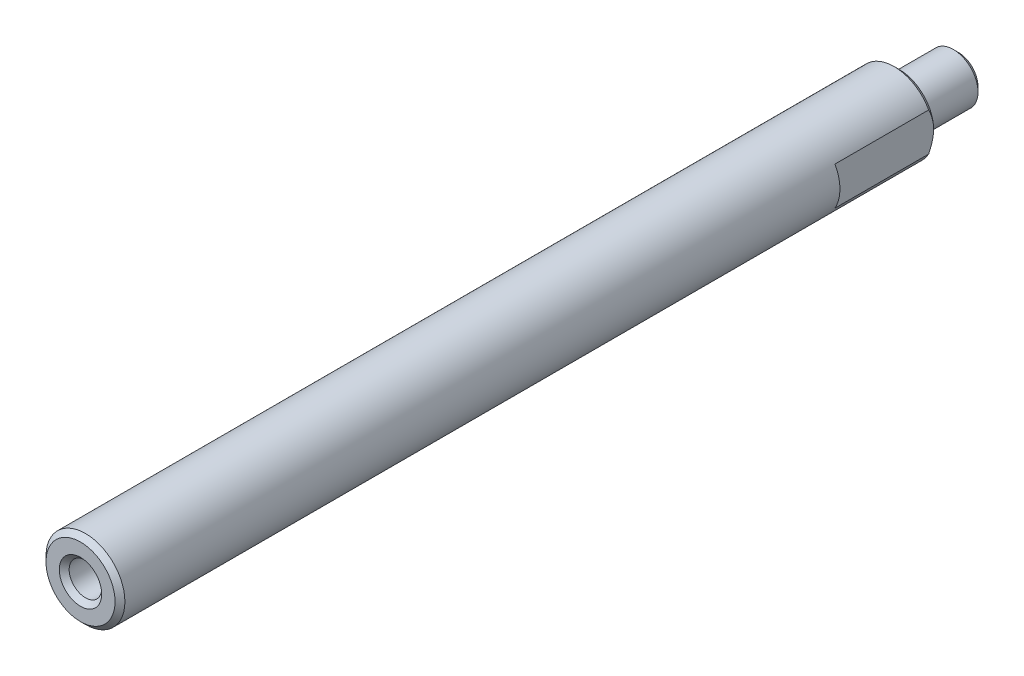
from build123d import *

# Parameters (mm, degrees)
SKETCH_1_R                       = 4
EXTRUDE_1_DEPTH                  = 41.5
HOLE_WIZARD_M4_1_D               = 3.3
HOLE_WIZARD_M4_1_DEPTH           = 12.1
HOLE_WIZARD_M4_1_TIP             = 0.991420021
HOLE_WIZARD_M4_1_ON_FACE_2_D     = 3.3
HOLE_WIZARD_M4_1_ON_FACE_2_DEPTH = 12.1
HOLE_WIZARD_M4_1_ON_FACE_2_TIP   = 0.991420021
CHAMFER_1_SIZE                   = 0.5
SKETCH_3_R                       = 2.5
EXTRUDE_1_2_DEPTH                = 6
CHAMFER_2_SIZE                   = 0.5
SKETCH_4_OUTSIDE_W               = 27.944
SKETCH_4_OUTSIDE_H               = 27.944
SKETCH_4_OUTSIDE_W_2             = 7
SKETCH_4_OUTSIDE_H_2             = 10.356925226
CUT_EXTRUDE_1_DEPTH              = 10


with BuildPart() as part:
    # 草图1 → Extrude 1 (new, symmetric)
    with BuildSketch(Plane.XY):
        Circle(SKETCH_1_R)
    extrude(amount=EXTRUDE_1_DEPTH, both=True)

    # M4 螺纹孔1
    with Locations(Plane.XY.offset(41.5)):
        with Locations((0, 0)):
            Hole(HOLE_WIZARD_M4_1_D / 2, depth=HOLE_WIZARD_M4_1_DEPTH)
            with Locations((0, 0, -(HOLE_WIZARD_M4_1_DEPTH + HOLE_WIZARD_M4_1_TIP / 2))):  # 118° drill point
                Cone(0, HOLE_WIZARD_M4_1_D / 2, HOLE_WIZARD_M4_1_TIP, mode=Mode.SUBTRACT)

    # M4 螺纹孔1 on face 2
    with Locations(Plane(origin=(0, 0, -41.5), x_dir=(-1, 0, 0), z_dir=(0, 0, -1))):
        with Locations((0, 0)):
            Hole(HOLE_WIZARD_M4_1_ON_FACE_2_D / 2, depth=HOLE_WIZARD_M4_1_ON_FACE_2_DEPTH)
            with Locations((0, 0, -(HOLE_WIZARD_M4_1_ON_FACE_2_DEPTH + HOLE_WIZARD_M4_1_ON_FACE_2_TIP / 2))):  # 118° drill point
                Cone(0, HOLE_WIZARD_M4_1_ON_FACE_2_D / 2, HOLE_WIZARD_M4_1_ON_FACE_2_TIP, mode=Mode.SUBTRACT)

    # 倒角1
    chamfer_1_edges = [part.edges().sort_by_distance(p)[0] for p in [
        (-4, 0, -41.5),
        (-4, 0, 41.5),
        (-1.65, 0, -41.5),
        (1.65, 0, 41.5),
    ]]
    chamfer(chamfer_1_edges, length=CHAMFER_1_SIZE)

    # 草图3 → Extrude 1 2 (add)
    with BuildSketch(Plane(origin=(0, 0, -41.5), x_dir=(-1, 0, 0), z_dir=(0, 0, -1))):
        with Locations(Location((0, 0, 0), (0, 0, 180))):
            Circle(SKETCH_3_R)
    extrude(amount=EXTRUDE_1_2_DEPTH)

    # 倒角2
    chamfer_2_edges = [part.edges().sort_by_distance(p)[0] for p in [
        (-2.5, 0, -47.5),
    ]]
    chamfer(chamfer_2_edges, length=CHAMFER_2_SIZE)

    # 草图4 outside → 切除-拉伸1 (cut)
    with BuildSketch(Plane(origin=(0, 0, -41.5), x_dir=(-1, 0, 0), z_dir=(0, 0, -1))):
        Rectangle(SKETCH_4_OUTSIDE_W, SKETCH_4_OUTSIDE_H)
        Rectangle(SKETCH_4_OUTSIDE_W_2, SKETCH_4_OUTSIDE_H_2, mode=Mode.SUBTRACT)
    extrude(amount=-CUT_EXTRUDE_1_DEPTH, mode=Mode.SUBTRACT)


solid = part.part
